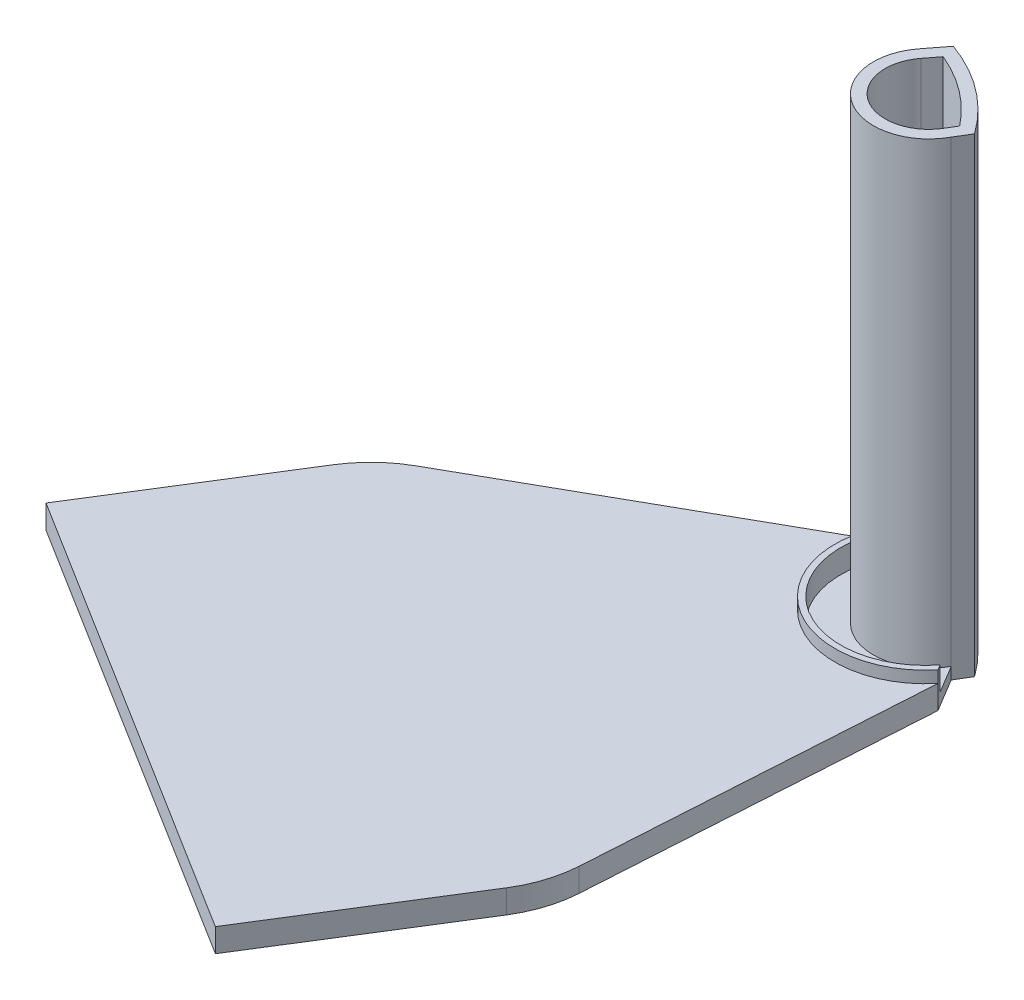
from build123d import *

# Parameters (mm, degrees)
SALIENTE_EXTRUIR3_DEPTH = 1
SALIENTE_EXTRUIR4_DEPTH = 2
SALIENTE_EXTRUIR5_DEPTH = 40
SALIENTE_EXTRUIR6_DEPTH = 2


with BuildPart() as part:
    # Croquis3 → Saliente-Extruir3 (new body)
    with BuildSketch(Plane(origin=(0, 62.385327456, 0), x_dir=(1, 0, 0), z_dir=(0, 1, 0))):
        with BuildLine():
            Line((-8.035911824, 0.88857317), (-4.660164738, 0.738374056))
            ThreePointArc((-4.660164738, 0.738374056), (-3.491878014, -6.094633439), (3.225323709, -4.38171595))
            Line((3.225323709, -4.38171595), (4.917369229, -7.202342932))
            ThreePointArc((4.917369229, -7.202342932), (-5.114744648, -8.849076594), (-8.035911824, 0.88857317))
        make_face()
    extrude(amount=SALIENTE_EXTRUIR3_DEPTH)

    # Croquis4 → Saliente-Extruir4 (add)
    with BuildSketch(Plane(origin=(0, 63.385327456, 0), x_dir=(1, 0, 0), z_dir=(0, 1, 0))):
        with BuildLine():
            Line((4.917369229, -7.202342932), (4.642987805, -6.74495119))
            ThreePointArc((4.642987805, -6.74495119), (-4.860151229, -8.418565495), (-7.493817117, 0.864453429))
            Line((-7.493817117, 0.864453429), (-8.035911824, 0.88857317))
            ThreePointArc((-8.035911824, 0.88857317), (-5.114744648, -8.849076594), (4.917369229, -7.202342932))
        make_face()
    extrude(amount=SALIENTE_EXTRUIR4_DEPTH)

    # Croquis1 → Saliente-Extruir5 (add)
    with BuildSketch(Plane(origin=(0, 62.385327456, 0), x_dir=(1, 0, 0), z_dir=(0, 1, 0))):
        with BuildLine():
            Line((-4.660164738, 0.738374056), (-3.38107943, 2.399345645))
            ThreePointArc((-3.38107943, 2.399345645), (0.723456308, 0.1886696), (3.976176138, -3.151108223))
            Line((3.976176138, -3.151108223), (3.225323709, -4.38171595))
            ThreePointArc((3.225323709, -4.38171595), (-3.491878014, -6.094633439), (-4.660164738, 0.738374056))
        make_face()
        with BuildLine():
            Line((-3.867867022, 0.128239376), (-3.043523867, 1.19870008))
            ThreePointArc((-3.043523867, 1.19870008), (0.147575108, -0.629578738), (2.769944661, -3.208123684))
            Line((2.769944661, -3.208123684), (2.357240199, -3.884524638))
            ThreePointArc((2.357240199, -3.884524638), (-2.936970885, -5.262605721), (-3.867867022, 0.128239376))
        make_face(mode=Mode.SUBTRACT)
    extrude(amount=SALIENTE_EXTRUIR5_DEPTH)

    # Croquis8 → Saliente-Extruir6 (add)
    with BuildSketch(Plane.XZ.offset(-62.385327456)):
        with BuildLine():
            ThreePointArc((3.121797308, 35.939024727), (2.663211319, 38.370313658), (1.621742308, 40.614597347))
            Line((1.621742308, 40.614597347), (-7.903634902, 55.858387398))
            Line((-7.903634902, 55.858387398), (-46.320213658, 31.853044728))
            Line((-46.320213658, 31.853044728), (-36.913147682, 16.798592231))
            ThreePointArc((-36.913147682, 16.798592231), (-35.343131478, 14.869681606), (-33.345658311, 13.38787594))
            Line((-33.345658311, 13.38787594), (-8.035911824, -0.88857317))
            ThreePointArc((-8.035911824, -0.88857317), (-5.114744648, 8.849076594), (4.917369229, 7.202342932))
            Line((4.917369229, 7.202342932), (3.121797308, 35.939024727))
        make_face()
    extrude(amount=-SALIENTE_EXTRUIR6_DEPTH)


solid = part.part
